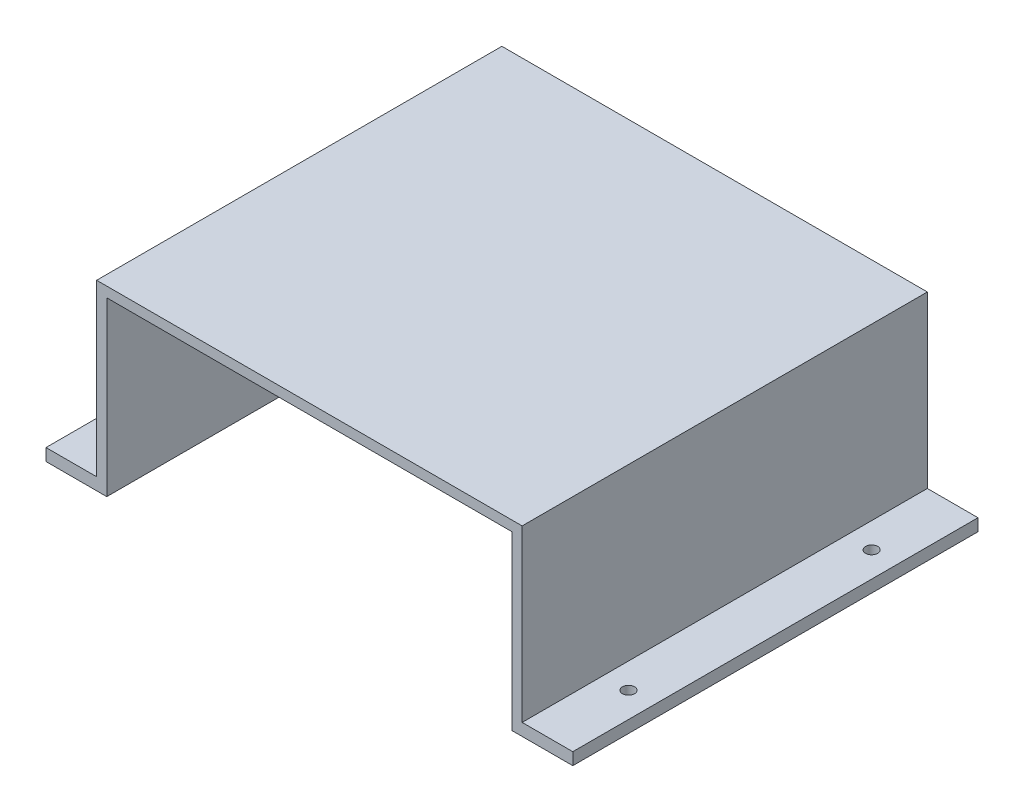
from build123d import *

# Parameters (mm, degrees)
SKETCH1_W           = 105
SKETCH1_H           = 75
SKETCH1_W_2         = 100
SKETCH1_H_2         = 70
BOSS_EXTRUDE1_DEPTH = 100
SKETCH1_2_W         = 105
SKETCH1_2_H         = 75
BOSS_EXTRUDE2_DEPTH = 3
BOSS_EXTRUDE3_DEPTH = 73
CUT_EXTRUDE3_START  = -21.5
CUT_EXTRUDE3_DEPTH  = 21.5
CUT_EXTRUDE4_START  = -30
CUT_EXTRUDE4_DEPTH  = 30
SKETCH7_W           = 26.515577751
SKETCH7_H           = 38.587429438
CUT_EXTRUDE5_DEPTH  = 71
SKETCH8_W           = 12.5
SKETCH8_H           = 100
SKETCH8_R           = 1.5
BOSS_EXTRUDE4_DEPTH = 3
SKETCH9_R           = 1.5
CUT_EXTRUDE6_DEPTH  = 6


with BuildPart() as part:
    # Sketch1 → Boss-Extrude1 (new body)
    with BuildSketch(Plane.XY):
        with Locations((-17.926459532, -39.040517308)):
            Rectangle(SKETCH1_W, SKETCH1_H)
        with Locations((-17.926459532, -39.040517308)):
            Rectangle(SKETCH1_W_2, SKETCH1_H_2, mode=Mode.SUBTRACT)
    extrude(amount=BOSS_EXTRUDE1_DEPTH)

    # Sketch1<2> → Boss-Extrude2 (add)
    with BuildSketch(Plane.XY):
        with Locations((-17.926459532, -39.040517308)):
            Rectangle(SKETCH1_2_W, SKETCH1_2_H)
    extrude(amount=BOSS_EXTRUDE2_DEPTH)

    # Sketch4 → Boss-Extrude3 (add)
    with BuildSketch(Plane(origin=(0, -1.540517308, 0), x_dir=(1, 0, 0), z_dir=(0, 1, 0))):
        with BuildLine():
            Line((32.352949433, -3), (-4.668670656, -3))
            ThreePointArc((-4.668670656, -3), (22.039856002, -20.992417524), (32.352949433, -51.5))
            Line((32.352949433, -51.5), (32.352949433, -3))
        make_face()
        with BuildLine():
            Line((-67.926459532, -3), (-67.926459532, -46.206705574))
            ThreePointArc((-67.926459532, -46.206705574), (-56.229094102, -18.928123314), (-31.184248407, -3))
            Line((-31.184248407, -3), (-67.926459532, -3))
        make_face()
    extrude(amount=-BOSS_EXTRUDE3_DEPTH)

    # Sketch5 → Cut-Extrude3 (cut)
    with BuildSketch(Plane.XZ.offset(76.540517308).offset(CUT_EXTRUDE3_START)):
        with BuildLine():
            Line((31.63486206, 100), (-67.926459532, 100))
            Line((-67.926459532, 100), (-67.926459532, 46.206705574))
            ThreePointArc((-67.926459532, 46.206705574), (-56.361491054, 19.084458701), (-31.579033768, 3.109647836))
            Line((-31.579033768, 3.109647836), (-4.273885295, 3.109647836))
            ThreePointArc((-4.273885295, 3.109647836), (19.456191853, 17.876253312), (31.63486206, 43.032747318))
            Line((31.63486206, 43.032747318), (31.63486206, 100))
        make_face()
    extrude(amount=CUT_EXTRUDE3_DEPTH, mode=Mode.SUBTRACT)

    # Sketch6 → Cut-Extrude4 (cut)
    with BuildSketch(Plane.XZ.offset(76.540517308).offset(CUT_EXTRUDE4_START)):
        with BuildLine():
            Line((-67.926459532, 46.206705574), (-67.926459532, 100))
            Line((-67.926459532, 100), (-70.426459532, 100))
            Line((-70.426459532, 100), (-70.426459532, 0))
            Line((-70.426459532, 0), (34.573540468, 0))
            Line((34.573540468, 0), (34.573540468, 100))
            Line((34.573540468, 100), (31.63486206, 100))
            Line((31.63486206, 100), (31.63486206, 43.032747318))
            ThreePointArc((31.63486206, 43.032747318), (19.456191853, 17.876253312), (-4.273885295, 3.109647836))
            Line((-4.273885295, 3.109647836), (-31.579033768, 3.109647836))
            ThreePointArc((-31.579033768, 3.109647836), (-56.361491054, 19.084458701), (-67.926459532, 46.206705574))
        make_face()
    extrude(amount=CUT_EXTRUDE4_DEPTH, mode=Mode.SUBTRACT)

    # Sketch7 → Cut-Extrude5 (cut)
    with BuildSketch(Plane.XY.offset(3)):
        with Locations((-17.926459532, -23.334232027)):
            Rectangle(SKETCH7_W, SKETCH7_H)
    extrude(amount=-CUT_EXTRUDE5_DEPTH, mode=Mode.SUBTRACT)

    # Sketch8 → Boss-Extrude4 (add)
    # profile 1 of 2: a face of its own
    with BuildSketch(Plane.XZ.offset(46.540517308)):
        with Locations((-76.676459532, 50)):
            Rectangle(SKETCH8_W, SKETCH8_H)
        with Locations((-76.676459532, 20)):
            Circle(SKETCH8_R, mode=Mode.SUBTRACT)
        with Locations((-76.676459532, 80)):
            Circle(SKETCH8_R, mode=Mode.SUBTRACT)
    # profile 2 of 2: a face of its own
    with BuildSketch(Plane.XZ.offset(46.540517308)):
        with Locations((40.823540468, 50)):
            Rectangle(SKETCH8_W, SKETCH8_H)
        with Locations((40.823540468, 20)):
            Circle(SKETCH8_R, mode=Mode.SUBTRACT)
        with Locations((40.823540468, 80)):
            Circle(SKETCH8_R, mode=Mode.SUBTRACT)
    extrude(amount=-BOSS_EXTRUDE4_DEPTH)

    # Sketch9 → Cut-Extrude6 (cut)
    with BuildSketch(Plane(origin=(0, 0, 0), x_dir=(-1, 0, 0), z_dir=(0, 0, -1))):
        with Locations((-24.573540468, -22.540517308)):
            Circle(SKETCH9_R)
        with Locations((60.426459532, -22.540517308)):
            Circle(SKETCH9_R)
    extrude(amount=-CUT_EXTRUDE6_DEPTH, mode=Mode.SUBTRACT)


solid = part.part
